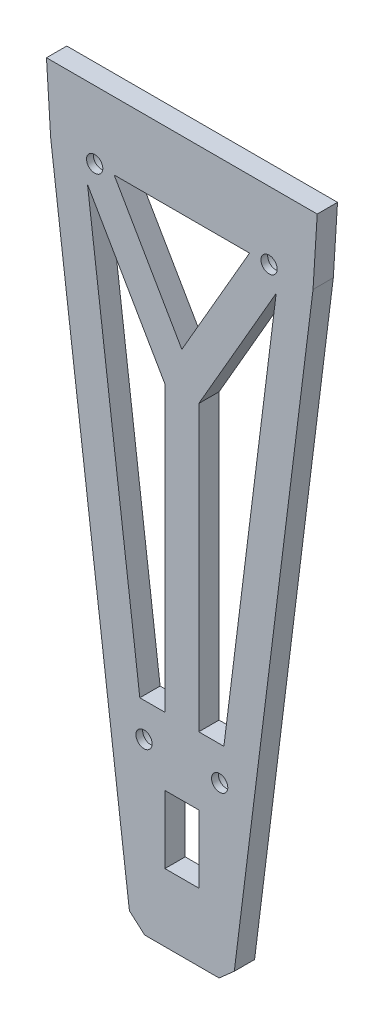
from build123d import *

# Parameters (mm, degrees)
EXTRUDE_1_DEPTH              = 3
CUT_EXTRUDE_1_REACH          = 104.025
SKETCH_2_W                   = 5
SKETCH_2_H                   = 10
HOLE_WIZARD_M2_1_D           = 2.4
HOLE_WIZARD_M2_1_CBORE_D     = 4.4
HOLE_WIZARD_M2_1_CBORE_DEPTH = 2
CUT_EXTRUDE_2_REACH          = 104.025
SKETCH_5_R                   = 4
HOLE_WIZARD_M2_2_D           = 2.4
HOLE_WIZARD_M2_2_CBORE_D     = 4.4
HOLE_WIZARD_M2_2_CBORE_DEPTH = 2
HOLE_WIZARD_M2_3_D           = 2.4
HOLE_WIZARD_M2_3_CBORE_D     = 4.4
HOLE_WIZARD_M2_3_CBORE_DEPTH = 2
CUT_EXTRUDE_3_DEPTH          = 3
HOLE_WIZARD_M2_5_D           = 2.4
HOLE_WIZARD_M2_5_CBORE_D     = 4.4
HOLE_WIZARD_M2_5_CBORE_DEPTH = 2
HOLE_WIZARD_M2_6_D           = 2.4
HOLE_WIZARD_M2_6_CBORE_D     = 4.4
HOLE_WIZARD_M2_6_CBORE_DEPTH = 2
CUT_EXTRUDE_4_DEPTH          = 10


with BuildPart() as part:
    # 草图1 → 凸台-拉伸1 (new body)
    with BuildSketch(Plane.XY):
        Polygon((20, 5), (20, 45), (19.258297735, 54.944681764), (13.241702265, 95.055318236), (7.5, 100), (-7.5, 100), (-13.241702265, 95.055318236), (-19.258297735, 54.944681764), (-20, 45), (-20, 5), (-19.379826327, -4.961389384), (-7.748069469, -98.015444247), (-5.5, -100), (5.5, -100), (7.748069469, -98.015444247), (19.379826327, -4.961389384), align=None)
    extrude(amount=EXTRUDE_1_DEPTH)

    # 草图2 → 切除-拉伸1 (cut, up to next)
    with BuildSketch(Plane.XY.offset(3), mode=Mode.PRIVATE) as cut_extrude_1_sk1:
        Polygon((10, -5), (-10, -5), (0, -22.320508076), align=None)
    cut_extrude_1_tool1 = extrude(cut_extrude_1_sk1.sketch, amount=-CUT_EXTRUDE_1_REACH, mode=Mode.PRIVATE) & part.part
    # 草图2 → 切除-拉伸1 (cut, up to next)
    with BuildSketch(Plane.XY.offset(3), mode=Mode.PRIVATE) as cut_extrude_1_sk2:
        Polygon((6.211088907, -70), (13.938881842, -8.177656525), (2.5, -27.990381057), (2.5, -70), align=None)
    cut_extrude_1_tool2 = extrude(cut_extrude_1_sk2.sketch, amount=-CUT_EXTRUDE_1_REACH, mode=Mode.PRIVATE) & part.part
    # 草图2 → 切除-拉伸1 (cut, up to next)
    with BuildSketch(Plane.XY.offset(3), mode=Mode.PRIVATE) as cut_extrude_1_sk3:
        Polygon((-13.938881842, -8.177656525), (-2.5, -27.990381057), (-2.5, -70), (-6.211088907, -70), align=None)
    cut_extrude_1_tool3 = extrude(cut_extrude_1_sk3.sketch, amount=-CUT_EXTRUDE_1_REACH, mode=Mode.PRIVATE) & part.part
    # 草图2 → 切除-拉伸1 (cut, up to next)
    with BuildSketch(Plane.XY.offset(3), mode=Mode.PRIVATE) as cut_extrude_1_sk4:
        with Locations((0, -85)):
            Rectangle(SKETCH_2_W, SKETCH_2_H)
    cut_extrude_1_tool4 = extrude(cut_extrude_1_sk4.sketch, amount=-CUT_EXTRUDE_1_REACH, mode=Mode.PRIVATE) & part.part
    add(cut_extrude_1_tool1.solids().sort_by_distance((0, -10.773503, 3))[0], mode=Mode.SUBTRACT)
    add(cut_extrude_1_tool2.solids().sort_by_distance((6.712708, -39.914502, 3))[0], mode=Mode.SUBTRACT)
    add(cut_extrude_1_tool3.solids().sort_by_distance((-6.712708, -39.914502, 3))[0], mode=Mode.SUBTRACT)
    add(cut_extrude_1_tool4.solids().sort_by_distance((0, -85, 3))[0], mode=Mode.SUBTRACT)

    # M2 凹头盖螺钉的柱形沉头孔1 (through all)
    with Locations(Plane(origin=(5.586088907, -75, 0), x_dir=(-1, 0, 0), z_dir=(0, 0, -1))):
        with Locations((0, 0), (11.172177814, 0)):
            CounterBoreHole(HOLE_WIZARD_M2_1_D / 2, HOLE_WIZARD_M2_1_CBORE_D / 2, HOLE_WIZARD_M2_1_CBORE_DEPTH)

    # 草图5 → 切除-拉伸2 (cut, up to next)
    with BuildSketch(Plane(origin=(0, 0, 0), x_dir=(-1, 0, 0), z_dir=(0, 0, -1)), mode=Mode.PRIVATE) as cut_extrude_2_sk1:
        with Locations((0, 25)):
            Circle(SKETCH_5_R)
    cut_extrude_2_tool1 = extrude(cut_extrude_2_sk1.sketch, amount=-CUT_EXTRUDE_2_REACH, mode=Mode.PRIVATE) & part.part
    add(cut_extrude_2_tool1.solids().sort_by_distance((0, 25, 0))[0], mode=Mode.SUBTRACT)

    # M2 凹头盖螺钉的柱形沉头孔2 (through all)
    with Locations(Plane(origin=(8, 25, 0), x_dir=(-1, 0, 0), z_dir=(0, 0, -1))):
        with Locations((0, 0), (8, 8), (16, 0), (8, -8)):
            CounterBoreHole(HOLE_WIZARD_M2_2_D / 2, HOLE_WIZARD_M2_2_CBORE_D / 2, HOLE_WIZARD_M2_2_CBORE_DEPTH)

    # M2 凹头盖螺钉的柱形沉头孔3 (through all)
    with Locations(Plane(origin=(12.880020708, -5.011657807, 0), x_dir=(-1, 0, 0), z_dir=(0, 0, -1))):
        with Locations((0, 0), (25.760041416, 0)):
            CounterBoreHole(HOLE_WIZARD_M2_3_D / 2, HOLE_WIZARD_M2_3_CBORE_D / 2, HOLE_WIZARD_M2_3_CBORE_DEPTH)

    # 草图10 → 切除-拉伸3 (cut)
    with BuildSketch(Plane(origin=(0, 0, 0), x_dir=(-1, 0, 0), z_dir=(0, 0, -1))):
        Polygon((-14.016935065, 56.180852205), (-10.679274874, 78.431920145), (-8.411945476, 80.068406675), (-4.470648492, 79.385634325), (-2.5, 77.04424815), (-2.5, 56.2029795), (-4.5, 54.2029795), (-12.313615971, 54.2029795), align=None)
        Polygon((-9.344020618, 87.333615184), (-8.2970205, 94.313615971), (0, 94.313615971), (8.2970205, 94.313615971), (9.344020618, 87.333615184), (7.670053032, 85.014356303), (0, 83.685631227), (-7.670053032, 85.014356303), align=None)
        Polygon((4.5, 54.2029795), (12.313615971, 54.2029795), (14.016935065, 56.180852205), (10.679274874, 78.431920145), (8.411945476, 80.068406675), (4.470648492, 79.385634325), (2.5, 77.04424815), (2.5, 56.2029795), align=None)
    extrude(amount=-CUT_EXTRUDE_3_DEPTH, mode=Mode.SUBTRACT)

    # M2 凹头盖螺钉的柱形沉头孔5 (through all)
    with Locations(Plane(origin=(0, 79.840052868, 0), x_dir=(-1, 0, 0), z_dir=(0, 0, -1))):
        with Locations((0, 0)):
            CounterBoreHole(HOLE_WIZARD_M2_5_D / 2, HOLE_WIZARD_M2_5_CBORE_D / 2, HOLE_WIZARD_M2_5_CBORE_DEPTH)

    # M2 凹头盖螺钉的柱形沉头孔6 (through all)
    with Locations(Plane(origin=(12.880020708, 14.988342193, 0), x_dir=(-1, 0, 0), z_dir=(0, 0, -1))):
        with Locations((0, 0), (25.760041416, 0)):
            CounterBoreHole(HOLE_WIZARD_M2_6_D / 2, HOLE_WIZARD_M2_6_CBORE_D / 2, HOLE_WIZARD_M2_6_CBORE_DEPTH)

    # 草图17 → 切除-拉伸4 (cut)
    with BuildSketch(Plane(origin=(0, 0, 0), x_dir=(-1, 0, 0), z_dir=(0, 0, -1))):
        Polygon((-20, 5), (20, 5), (20, 99.998273705), (7.5, 100), (-7.5, 100), (-20, 99.998273705), align=None)
    extrude(amount=-CUT_EXTRUDE_4_DEPTH, mode=Mode.SUBTRACT)


solid = part.part
